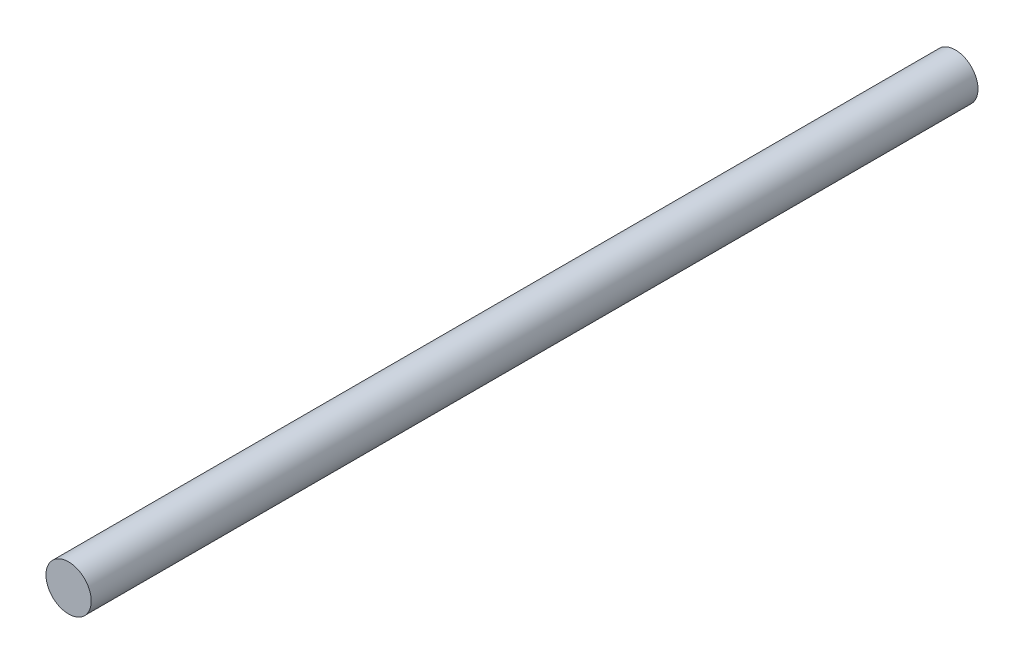
from build123d import *

# Parameters (mm, degrees)
SKETCH1_R           = 1.94
BOSS_EXTRUDE1_DEPTH = 76


with BuildPart() as part:
    # Sketch1 → Boss-Extrude1 (new body)
    with BuildSketch(Plane.XY):
        Circle(SKETCH1_R)
    extrude(amount=BOSS_EXTRUDE1_DEPTH)


solid = part.part
